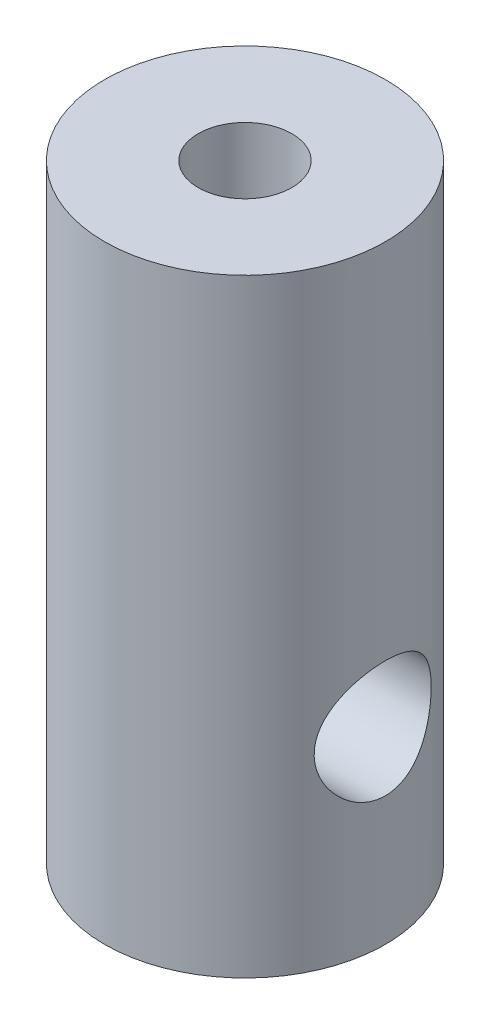
from build123d import *

# Parameters (mm, degrees)
ESQUISSE1_R                  = 3
BOSS_EXTRU_1_DEPTH           = 13
ESQUISSE2_R                  = 1
ENL_V_MAT_EXTRU_1_DEPTH      = 14.674794331
ENL_V_MAT_EXTRU_3_DEPTH      = 14.674794331
ENL_V_MAT_EXTRU_3_DEPTH_BACK = 14.674794331
ESQUISSE4_R                  = 1.25


with BuildPart() as part:
    # Esquisse1 → Boss.-Extru.1 (new body)
    with BuildSketch(Plane(origin=(0, 0, 0), x_dir=(1, 0, 0), z_dir=(0, 1, 0))):
        with Locations(Location((0, 0, 0), (0, 0, 270))):
            Circle(ESQUISSE1_R)
    extrude(amount=BOSS_EXTRU_1_DEPTH)

    # Esquisse2 → Enlèv. mat.-Extru.1 (cut, through all)
    with BuildSketch(Plane.XZ):
        with Locations(Location((0, 0, 0), (0, 0, 270))):
            Circle(ESQUISSE2_R)
    extrude(amount=-ENL_V_MAT_EXTRU_1_DEPTH, mode=Mode.SUBTRACT)

    # Esquisse4 → Enlèv. mat.-Extru.3 (cut, two sides: drawn at the far end of the back side and taken through both)
    with BuildSketch(Plane(origin=(0, 0, 0), x_dir=(0, 0, -1), z_dir=(1, 0, 0)).offset(-ENL_V_MAT_EXTRU_3_DEPTH_BACK)):
        with Locations((0, 4)):
            Circle(ESQUISSE4_R)
    extrude(amount=ENL_V_MAT_EXTRU_3_DEPTH + ENL_V_MAT_EXTRU_3_DEPTH_BACK, mode=Mode.SUBTRACT)


solid = part.part
